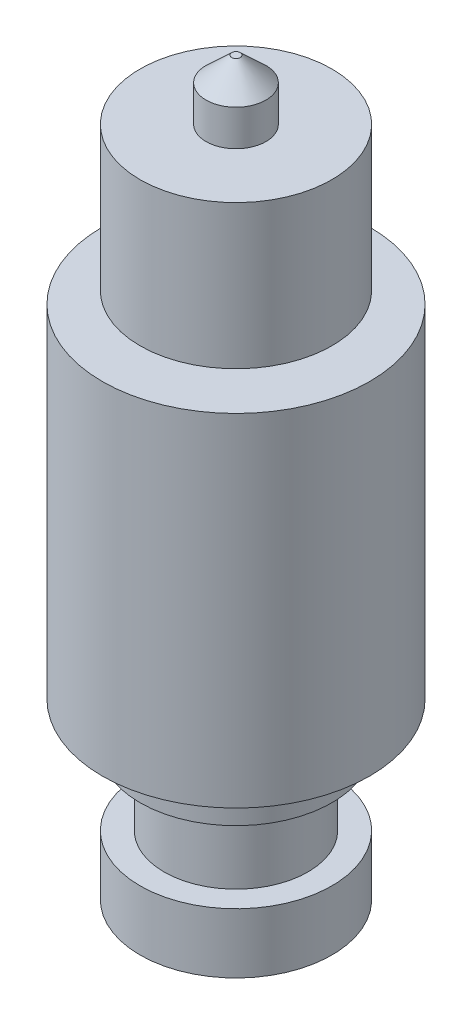
from build123d import *

# Parameters (mm, degrees)
SKETCH1_R           = 8
BOSS_EXTRUDE1_DEPTH = 5
SKETCH2_R           = 6
BOSS_EXTRUDE2_DEPTH = 6
SKETCH3_R           = 8
BOSS_EXTRUDE3_DEPTH = 1.5
SKETCH4_R           = 5
BOSS_EXTRUDE4_DEPTH = 2
SKETCH5_R           = 11.15
BOSS_EXTRUDE5_DEPTH = 28.5
SKETCH6_R           = 2
BOSS_EXTRUDE6_DEPTH = 1
SKETCH7_R           = 8
BOSS_EXTRUDE7_DEPTH = 12
SKETCH8_R           = 2.5
BOSS_EXTRUDE8_DEPTH = 3
SKETCH9_R           = 2.5
BOSS_EXTRUDE9_DEPTH = 2
BOSS_EXTRUDE9_TAPER = 47


with BuildPart() as part:
    # Sketch1 → Boss-Extrude1 (new body)
    with BuildSketch(Plane(origin=(0, 0, 0), x_dir=(1, 0, 0), z_dir=(0, 1, 0))):
        with Locations(Location((0, 0, 0), (0, 0, 270))):
            Circle(SKETCH1_R)
    extrude(amount=BOSS_EXTRUDE1_DEPTH)

    # Sketch2 → Boss-Extrude2 (add)
    with BuildSketch(Plane(origin=(0, 5, 0), x_dir=(1, 0, 0), z_dir=(0, 1, 0))):
        with Locations(Location((0, 0, 0), (0, 0, 270))):
            Circle(SKETCH2_R)
    extrude(amount=BOSS_EXTRUDE2_DEPTH)

    # Sketch3 → Boss-Extrude3 (add)
    with BuildSketch(Plane(origin=(0, 11, 0), x_dir=(1, 0, 0), z_dir=(0, 1, 0))):
        with Locations(Location((0, 0, 0), (0, 0, 270))):
            Circle(SKETCH3_R)
    extrude(amount=BOSS_EXTRUDE3_DEPTH)

    # Sketch4 → Boss-Extrude4 (add)
    with BuildSketch(Plane(origin=(0, 12.5, 0), x_dir=(1, 0, 0), z_dir=(0, 1, 0))):
        with Locations(Location((0, 0, 0), (0, 0, 270))):
            Circle(SKETCH4_R)
    extrude(amount=BOSS_EXTRUDE4_DEPTH)

    # Sketch5 → Boss-Extrude5 (add)
    with BuildSketch(Plane(origin=(0, 14.5, 0), x_dir=(1, 0, 0), z_dir=(0, 1, 0))):
        with Locations(Location((0, 0, 0), (0, 0, 90))):
            Circle(SKETCH5_R)
    extrude(amount=BOSS_EXTRUDE5_DEPTH)

    # Sketch6 → Boss-Extrude6 (add)
    with BuildSketch(Plane(origin=(0, 43, 0), x_dir=(1, 0, 0), z_dir=(0, 1, 0))):
        with Locations(Location((0, 0, 0), (0, 0, 270))):
            Circle(SKETCH6_R)
    extrude(amount=BOSS_EXTRUDE6_DEPTH)

    # Sketch7 → Boss-Extrude7 (add)
    with BuildSketch(Plane(origin=(0, 44, 0), x_dir=(1, 0, 0), z_dir=(0, 1, 0))):
        with Locations(Location((0, 0, 0), (0, 0, 270))):
            Circle(SKETCH7_R)
    extrude(amount=BOSS_EXTRUDE7_DEPTH)

    # Sketch8 → Boss-Extrude8 (add)
    with BuildSketch(Plane(origin=(0, 56, 0), x_dir=(1, 0, 0), z_dir=(0, 1, 0))):
        with Locations(Location((0, 0, 0), (0, 0, 270))):
            Circle(SKETCH8_R)
    extrude(amount=BOSS_EXTRUDE8_DEPTH)

    # Sketch9 → Boss-Extrude9 (add)
    with BuildSketch(Plane(origin=(0, 59, 0), x_dir=(1, 0, 0), z_dir=(0, 1, 0))):
        with Locations(Location((0, 0, 0), (0, 0, 270))):
            Circle(SKETCH9_R)
    extrude(amount=BOSS_EXTRUDE9_DEPTH, taper=BOSS_EXTRUDE9_TAPER)


solid = part.part
